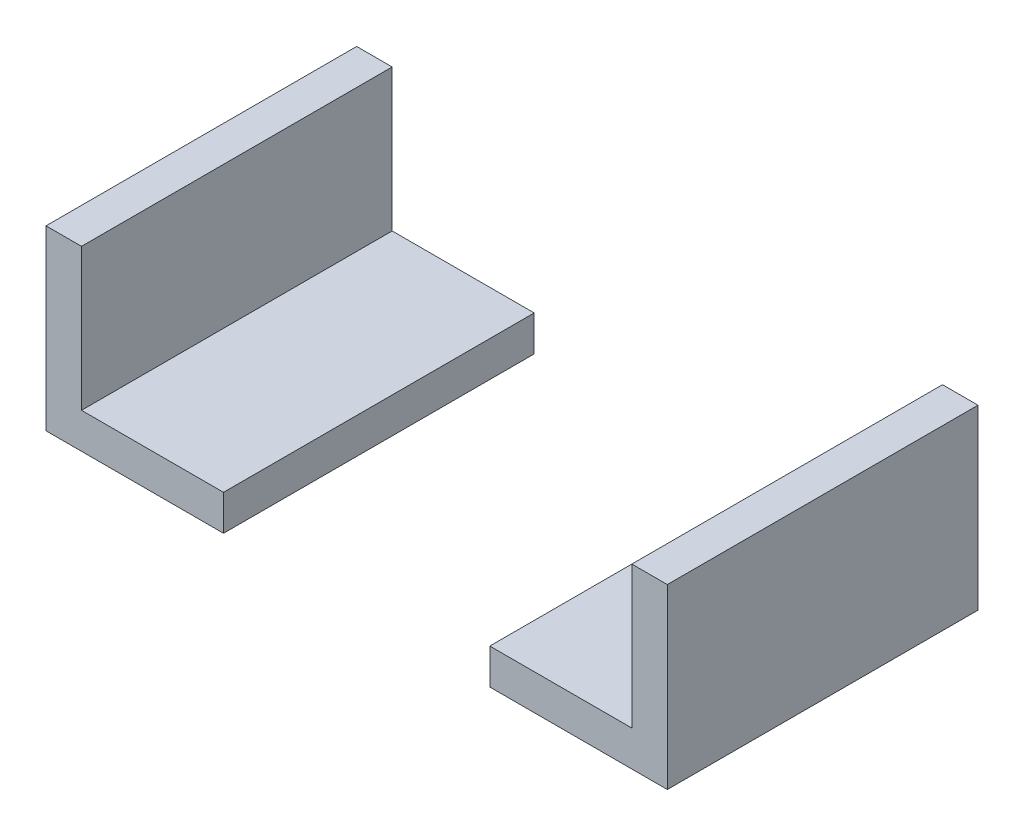
from build123d import *

# Parameters (mm, degrees)
EXTRUDE_1_DEPTH     = 70
EXTRUDE_1_2_DEPTH   = 70
SKETCH_2_R          = 2.15
CUT_EXTRUDE_1_DEPTH = 5.5


with BuildPart() as part:
    # 草图1 → 凸台-拉伸1 (new body)
    with BuildSketch(Plane.XY):
        Polygon((-10.417681783, 23.1011135), (-2.417681783, 23.1011135), (-2.417681783, -8.8988865), (29.582318217, -8.8988865), (29.582318217, -16.8988865), (-10.417681783, -16.8988865), align=None)
    extrude(amount=EXTRUDE_1_DEPTH)


with BuildPart() as body_2:
    # 草图1 → Extrude 1 2 (new body)
    with BuildSketch(Plane.XY):
        Polygon((129.582318217, -16.8988865), (129.582318217, 23.1011135), (121.582318217, 23.1011135), (121.582318217, -8.8988865), (89.582318217, -8.8988865), (89.582318217, -16.8988865), align=None)
    extrude(amount=EXTRUDE_1_2_DEPTH)


with BuildPart() as cut_extrude_1_tool:
    # 草图2 → 切除-拉伸1 (new body)
    with BuildSketch(Plane(origin=(0, 0, 0), x_dir=(-1, 0, 0), z_dir=(0, 0, -1))):
        with Locations((-125.582318217, 2.1011135)):
            Circle(SKETCH_2_R)
        with Locations((-115.582318217, -12.8988865)):
            Circle(SKETCH_2_R)
        with Locations((-3.582318217, -12.8988865)):
            Circle(SKETCH_2_R)
        with Locations((6.417681783, 2.1011135)):
            Circle(SKETCH_2_R)
    extrude(amount=-CUT_EXTRUDE_1_DEPTH)


with BuildPart() as part_1:
    add(part.part)

    # 切除-拉伸1: cut by cut_extrude_1_tool
    add(cut_extrude_1_tool.part, mode=Mode.SUBTRACT)


with BuildPart() as body_2_1:
    add(body_2.part)

    # 切除-拉伸1: cut by cut_extrude_1_tool
    add(cut_extrude_1_tool.part, mode=Mode.SUBTRACT)


solid = Compound([part_1.part, body_2_1.part])
